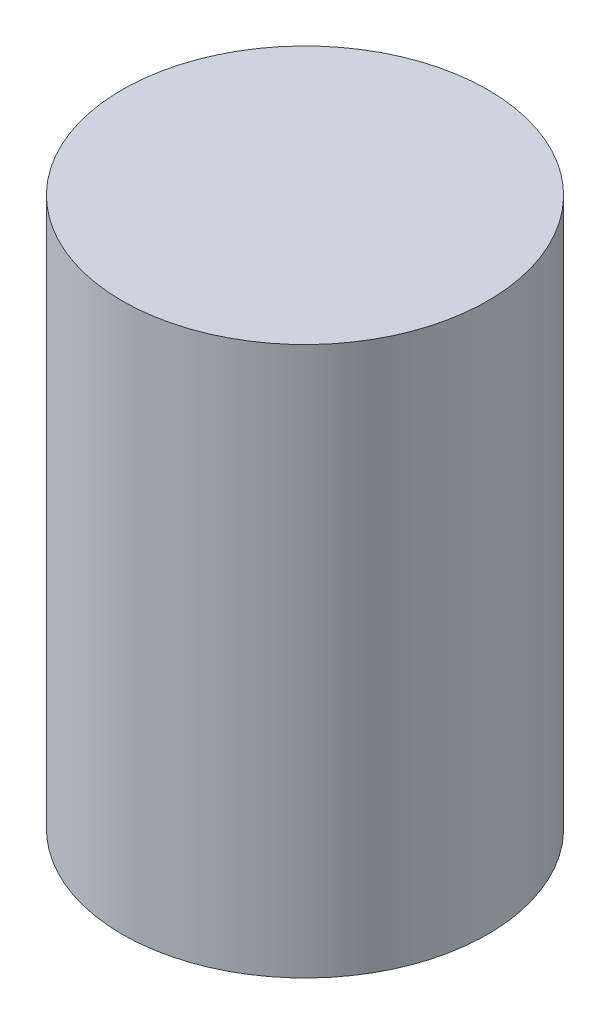
from build123d import *

# Parameters (mm, degrees)
SKETCH_1_R      = 10
EXTRUDE_2_DEPTH = 30


with BuildPart() as part:
    # 草图1 → 凸台-拉伸2 (new body)
    with BuildSketch(Plane(origin=(0, 0, 0), x_dir=(1, 0, 0), z_dir=(0, 1, 0))):
        with Locations(Location((0, 0, 0), (0, 0, 270))):
            Circle(SKETCH_1_R)
    extrude(amount=EXTRUDE_2_DEPTH)


solid = part.part
